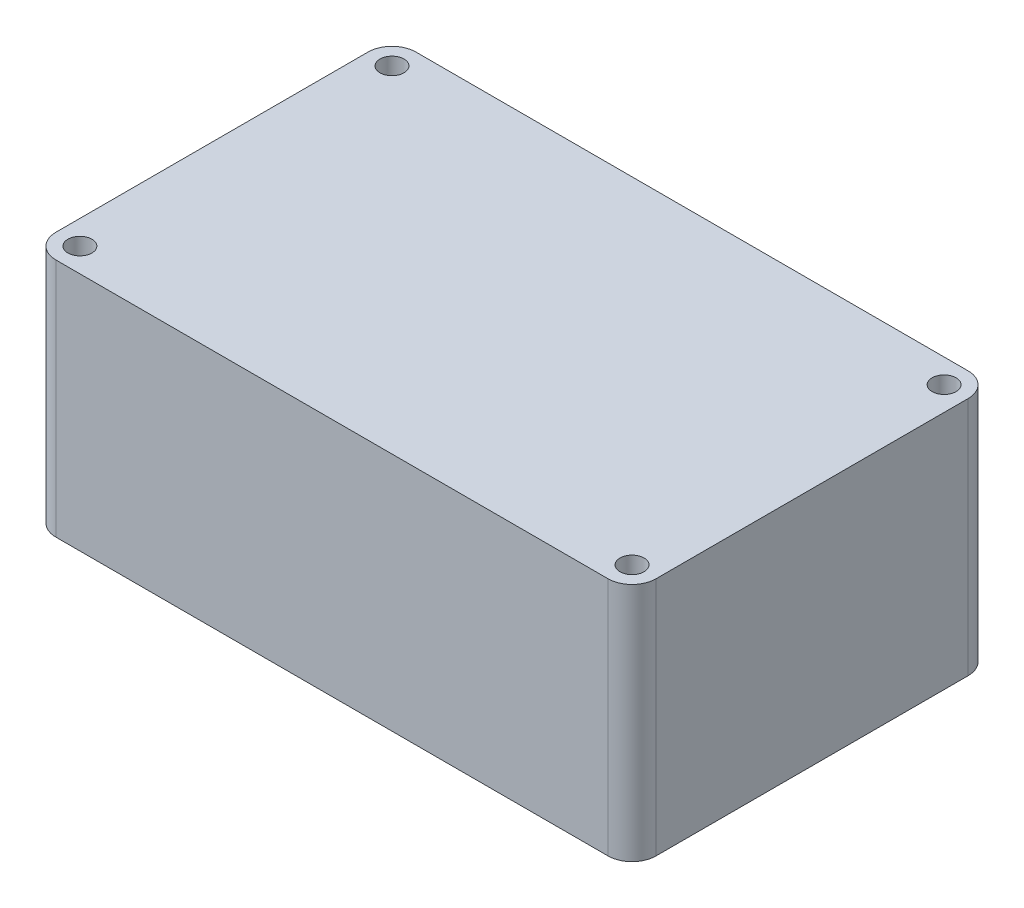
from build123d import *

# Parameters (mm, degrees)
CROQUIS1_W                                 = 250
CROQUIS1_H                                 = 150
SALIENTE_EXTRUIR1_DEPTH                    = 100
REDONDEO1_R                                = 10
CROQUIS2_R                                 = 5
CORTAR_EXTRUIR1_DEPTH                      = 177.776695297
SIMETR_A1_AT_THE_SECOND_PLANE_COPY_1_SKE_R = 5
SIMETR_A1_AT_THE_SECOND_PLANE_COPY_1_DEPTH = 177.776695297


with BuildPart() as part:
    # Croquis1 → Saliente-Extruir1 (new body)
    with BuildSketch(Plane(origin=(0, 0, 0), x_dir=(1, 0, 0), z_dir=(0, 1, 0))):
        Rectangle(CROQUIS1_W, CROQUIS1_H)
    extrude(amount=SALIENTE_EXTRUIR1_DEPTH)

    # Redondeo1
    redondeo1_edges = [part.edges().sort_by_distance(p)[0] for p in [
        (-125, 50, -75),
        (125, 50, -75),
        (125, 50, 75),
        (-125, 50, 75),
    ]]
    fillet(redondeo1_edges, radius=REDONDEO1_R)

    # Croquis2 → Cortar-Extruir1 (cut, through all)
    with BuildSketch(Plane(origin=(0, 100, 0), x_dir=(1, 0, 0), z_dir=(0, 1, 0))):
        with Locations(Location((-115, 65, 0), (0, 0, 270))):
            Circle(CROQUIS2_R)
    cortar_extruir1 = extrude(amount=-CORTAR_EXTRUIR1_DEPTH, mode=Mode.SUBTRACT)

    # Simetría1: Cortar-Extruir1 across plane
    add(cortar_extruir1.mirror(Plane.XY), mode=Mode.SUBTRACT)

    # Simetría1 at the second plane: Cortar-Extruir1 across plane
    add(cortar_extruir1.mirror(Plane(origin=(0, 0, 0), x_dir=(0, 0, 1), z_dir=(1, 0, 0))), mode=Mode.SUBTRACT)

    # Simetría1 at the second plane copy 1 ske → Simetría1 at the second plane copy 1 (cut, through all)
    with BuildSketch(Plane(origin=(0, 100, 0), x_dir=(-1, 0, 0), z_dir=(0, 1, 0))):
        with Locations(Location((-115, 65, 0), (0, 0, 270))):
            Circle(SIMETR_A1_AT_THE_SECOND_PLANE_COPY_1_SKE_R)
    extrude(amount=-SIMETR_A1_AT_THE_SECOND_PLANE_COPY_1_DEPTH, mode=Mode.SUBTRACT)


solid = part.part
